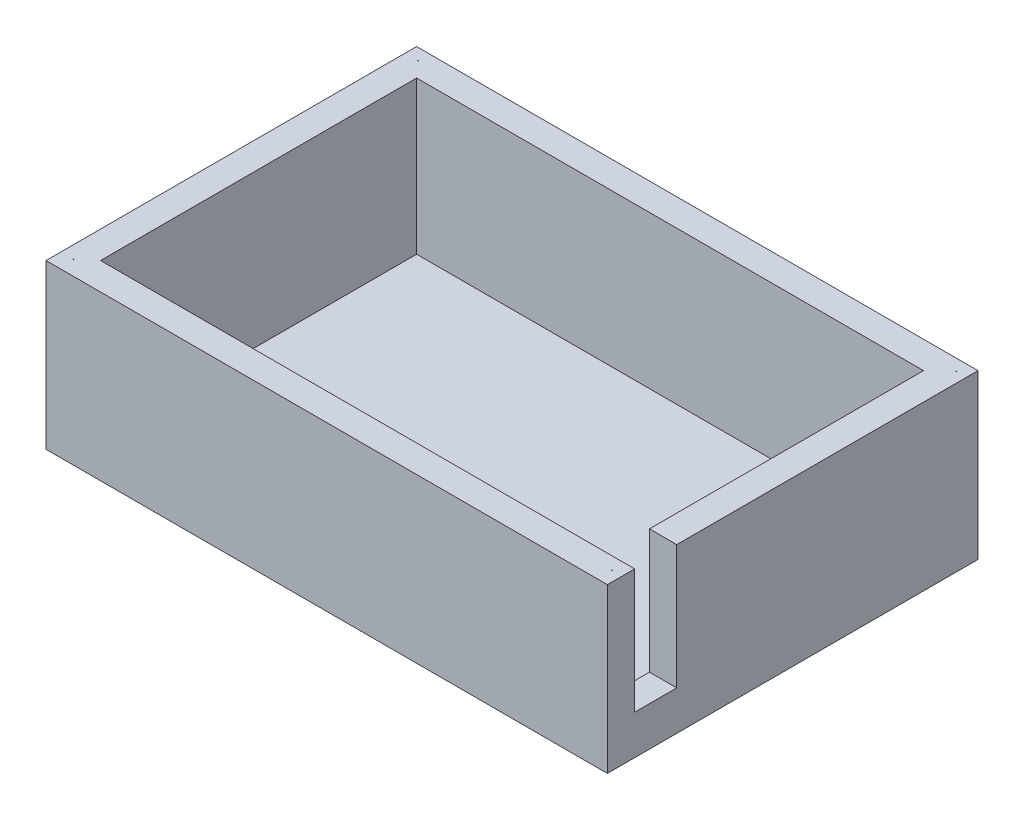
from build123d import *

# Parameters (mm, degrees)
SKETCH1_W                    = 103
SKETCH1_H                    = 68
BOSS_EXTRUDE1_DEPTH          = 30
SKETCH2_W                    = 92.99558251
SKETCH2_H                    = 57.998770124
CUT_EXTRUDE1_DEPTH           = 28
SKETCH3_W                    = 7.71242133
SKETCH3_H                    = 22.765769716
CUT_EXTRUDE2_DEPTH           = 28
F_97_0_0059_DIAMETER_HOLE1_D = 0.14986


with BuildPart() as part:
    # Sketch1 → Boss-Extrude1 (new body)
    with BuildSketch(Plane(origin=(0, 0, 0), x_dir=(1, 0, 0), z_dir=(0, 1, 0))):
        with Locations((-0.5, 0.75)):
            Rectangle(SKETCH1_W, SKETCH1_H)
    extrude(amount=BOSS_EXTRUDE1_DEPTH)

    # Sketch2 → Cut-Extrude1 (cut)
    with BuildSketch(Plane(origin=(51, 30, -34.75), x_dir=(1, 0, 0), z_dir=(0, -1, 0))):
        with Locations((-51.502635722, 33.995679306)):
            Rectangle(SKETCH2_W, SKETCH2_H)
    extrude(amount=CUT_EXTRUDE1_DEPTH, mode=Mode.SUBTRACT)

    # Sketch3 → Cut-Extrude2 (cut)
    with BuildSketch(Plane(origin=(51, 0, 0), x_dir=(0, 0, -1), z_dir=(1, 0, 0))):
        with Locations((-24.383198114, 18.617115142)):
            Rectangle(SKETCH3_W, SKETCH3_H)
    extrude(amount=-CUT_EXTRUDE2_DEPTH, mode=Mode.SUBTRACT)

    # #97 (0.0059) Diameter Hole1 (through all)
    with Locations(Plane(origin=(0, 30, 0), x_dir=(1, 0, 0), z_dir=(0, 1, 0))):
        with Locations((49.13026129, -30.550335592), (49.13026129, 32.624025804), (-49.65125644, 32.624025804), (-49.65125644, -30.550335592)):
            Hole(F_97_0_0059_DIAMETER_HOLE1_D / 2)


solid = part.part
